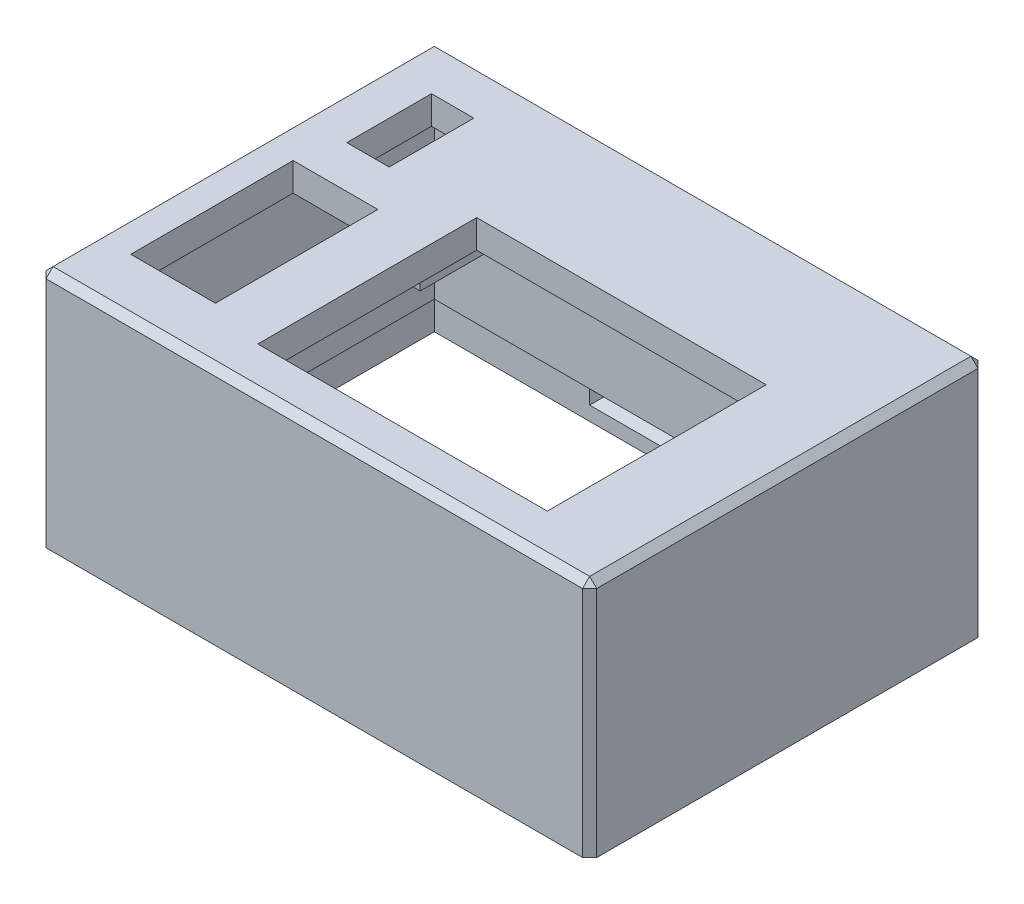
from build123d import *

# Parameters (mm, degrees)
SKETCH_1_W               = 39
SKETCH_1_H               = 28
EXTRUDE_1_DEPTH          = 17
SKETCH_2_W               = 20.5
SKETCH_2_H               = 15.5
CUT_EXTRUDE_1_DEPTH      = 34.228376427
SKETCH_3_W               = 35
SKETCH_3_H               = 24
CUT_EXTRUDE_2_DEPTH      = 15
SKETCH_5_W               = 6
SKETCH_5_H               = 11.5
CUT_EXTRUDE_4_DEPTH      = 34.228376427
SKETCH_7_W               = 3
SKETCH_7_H               = 6
CUT_EXTRUDE_5_DEPTH      = 34.228376427
SKETCH_6_W               = 2.5
SKETCH_6_H               = 8
SKETCH_6_H_2             = 2.5
SKETCH_6_W_2             = 8
SKETCH_6_H_3             = 1.2
SKETCH_6_W_3             = 2
EXTRUDE_2_DEPTH          = 4
SKETCH_8_W               = 37
SKETCH_8_H               = 26
CUT_EXTRUDE_6_DEPTH      = 3
SKETCH_9_W               = 15
SKETCH_9_H               = 2
CUT_EXTRUDE_7_DEPTH      = 0.5
CUT_EXTRUDE_7_DRAFT      = -45
MIRROR_1_COPY_1_SKETCH_W = 15
MIRROR_1_COPY_1_SKETCH_H = 2
MIRROR_1_COPY_1_DEPTH    = 0.5
MIRROR_1_COPY_1_DRAFT    = -45
CUT_EXTRUDE_8_REACH      = 41.882
SKETCH_12_W              = 4
SKETCH_12_H              = 2.5
CHAMFER_1_SIZE           = 0.5
SKETCH_13_W              = 4
SKETCH_13_H              = 1
CUT_EXTRUDE_9_DEPTH      = 11.7


with BuildPart() as part:
    # Эскиз1 → Бобышка-Вытянуть1 (new body)
    with BuildSketch(Plane(origin=(0, 0, 0), x_dir=(1, 0, 0), z_dir=(0, 1, 0))):
        with Locations((-3.25, 3.25)):
            Rectangle(SKETCH_1_W, SKETCH_1_H)
    extrude(amount=EXTRUDE_1_DEPTH)

    # Эскиз2 → Вырез-Вытянуть1 (cut, through all)
    with BuildSketch(Plane(origin=(0, 0, 0), x_dir=(1, 0, 0), z_dir=(0, 1, 0))):
        Rectangle(SKETCH_2_W, SKETCH_2_H)
    extrude(amount=CUT_EXTRUDE_1_DEPTH, mode=Mode.SUBTRACT)

    # Эскиз3 → Вырез-Вытянуть2 (cut)
    with BuildSketch(Plane(origin=(0, 0, 0), x_dir=(1, 0, 0), z_dir=(0, 1, 0))):
        with Locations((-3.25, 3.25)):
            Rectangle(SKETCH_3_W, SKETCH_3_H)
    extrude(amount=CUT_EXTRUDE_2_DEPTH, mode=Mode.SUBTRACT)

    # Эскиз5 → Вырез-Вытянуть4 (cut, through all)
    with BuildSketch(Plane(origin=(0, 0, 0), x_dir=(1, 0, 0), z_dir=(0, 1, 0))):
        with Locations((-17.25, -1)):
            Rectangle(SKETCH_5_W, SKETCH_5_H)
    extrude(amount=CUT_EXTRUDE_4_DEPTH, mode=Mode.SUBTRACT)

    # Эскиз7 → Вырез-Вытянуть5 (cut, through all)
    with BuildSketch(Plane(origin=(0, 0, 0), x_dir=(1, 0, 0), z_dir=(0, 1, 0))):
        with Locations((-17.95, 10.75)):
            Rectangle(SKETCH_7_W, SKETCH_7_H)
    extrude(amount=CUT_EXTRUDE_5_DEPTH, mode=Mode.SUBTRACT)

    # Эскиз6 → Бобышка-Вытянуть2 (add)
    with BuildSketch(Plane.XZ.offset(-15)):
        with Locations((13, -11.25)):
            Rectangle(SKETCH_6_W, SKETCH_6_H)
        with Locations((13, 7.5)):
            Rectangle(SKETCH_6_W, SKETCH_6_H_2)
        with Locations((-16.75, 8.15)):
            Rectangle(SKETCH_6_W_2, SKETCH_6_H_3)
        with Locations((-14.75, -11.25)):
            Rectangle(SKETCH_6_W_3, SKETCH_6_H)
    extrude(amount=EXTRUDE_2_DEPTH)

    # Эскиз8 → Вырез-Вытянуть6 (cut)
    with BuildSketch(Plane(origin=(0, 0, 0), x_dir=(1, 0, 0), z_dir=(0, 1, 0))):
        with Locations((-3.25, 3.25)):
            Rectangle(SKETCH_8_W, SKETCH_8_H)
    extrude(amount=CUT_EXTRUDE_6_DEPTH, mode=Mode.SUBTRACT)


with BuildPart() as cut_extrude_7_tool:
    # Эскиз9 → Вырез-Вытянуть7 (with draft: the straight prism first)
    with BuildSketch(Plane.XY.offset(-16.25)):
        with Locations((-3.25, 2)):
            Rectangle(SKETCH_9_W, SKETCH_9_H)
    extrude(amount=-CUT_EXTRUDE_7_DEPTH)
    # Вырез-Вытянуть7: the draft: its side faces are tilted about the plane it starts from
    cut_extrude_7_sides = [cut_extrude_7_tool.faces().sort_by_distance(p)[0] for p in [
        (-10.75, 2, -16.5),
        (-3.25, 1, -16.5),
        (4.25, 2, -16.5),
        (-3.25, 3, -16.5),
    ]]
    draft(cut_extrude_7_sides, Plane.XY.offset(-16.25), CUT_EXTRUDE_7_DRAFT)


with BuildPart() as part_1:
    add(part.part)

    # Вырез-Вытянуть7: cut by cut_extrude_7_tool
    add(cut_extrude_7_tool.part, mode=Mode.SUBTRACT)


with BuildPart() as mirror_1_copy_1_tool:
    # Зеркальное отражение1 copy 1 sketch → Зеркальное отражение1 copy 1 (with draft: the straight prism first)
    with BuildSketch(Plane(origin=(0, 0, 9.75), x_dir=(1, 0, 0), z_dir=(0, 0, -1))):
        with Locations((-3.25, -2)):
            Rectangle(MIRROR_1_COPY_1_SKETCH_W, MIRROR_1_COPY_1_SKETCH_H)
    extrude(amount=-MIRROR_1_COPY_1_DEPTH)
    # Зеркальное отражение1 copy 1: the draft: its side faces are tilted about the plane it starts from
    mirror_1_copy_1_sides = [mirror_1_copy_1_tool.faces().sort_by_distance(p)[0] for p in [
        (-10.75, 2, 10),
        (-3.25, 1, 10),
        (4.25, 2, 10),
        (-3.25, 3, 10),
    ]]
    draft(mirror_1_copy_1_sides, Plane(origin=(0, 0, 9.75), x_dir=(1, 0, 0), z_dir=(0, 0, -1)), MIRROR_1_COPY_1_DRAFT)


with BuildPart() as part_2:
    add(part_1.part)

    # Зеркальное отражение1 copy 1: cut by mirror_1_copy_1_tool
    add(mirror_1_copy_1_tool.part, mode=Mode.SUBTRACT)

    # Эскиз12 → Вырез-Вытянуть8 (cut, up to next)
    with BuildSketch(Plane(origin=(0, 0, -17.25), x_dir=(-1, 0, 0), z_dir=(0, 0, -1)), mode=Mode.PRIVATE) as cut_extrude_8_sk1:
        with Locations((-8.25, 12.95)):
            Rectangle(SKETCH_12_W, SKETCH_12_H)
    cut_extrude_8_tool1 = extrude(cut_extrude_8_sk1.sketch, amount=-CUT_EXTRUDE_8_REACH, mode=Mode.PRIVATE) & part_2.part
    add(cut_extrude_8_tool1.solids().sort_by_distance((8.25, 12.95, -17.25))[0], mode=Mode.SUBTRACT)

    # Фаска1
    chamfer_1_edges = [part_2.edges().sort_by_distance(p)[0] for p in [
        (16.25, 17, -3.25),
        (-3.25, 17, -17.25),
        (-22.75, 17, -3.25),
        (-22.75, 8.5, -17.25),
        (16.25, 8.5, -17.25),
        (16.25, 8.5, 10.75),
        (-22.75, 8.5, 10.75),
        (-3.25, 17, 10.75),
    ]]
    chamfer(chamfer_1_edges, length=CHAMFER_1_SIZE)

    # Эскиз13 → Вырез-Вытянуть9 (cut)
    with BuildSketch(Plane(origin=(0, 0, 0), x_dir=(1, 0, 0), z_dir=(0, 1, 0))):
        with Locations((8.25, 15.75)):
            Rectangle(SKETCH_13_W, SKETCH_13_H)
    extrude(amount=CUT_EXTRUDE_9_DEPTH, mode=Mode.SUBTRACT)


solid = part_2.part
